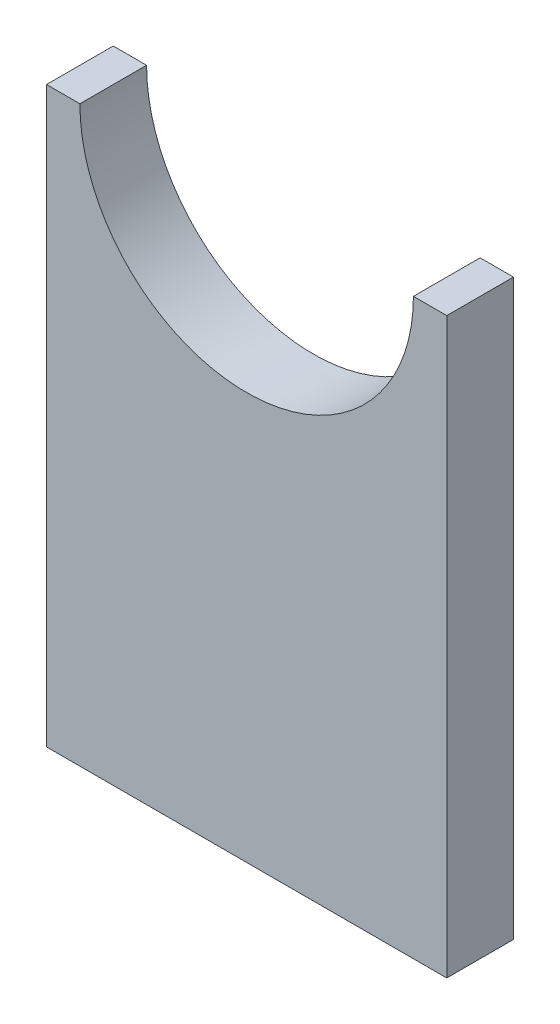
from build123d import *

# Parameters (mm, degrees)
SKETCH2_W           = 30
SKETCH2_H           = 43
BOSS_EXTRUDE2_DEPTH = 5
SKETCH3_R           = 12.5
CUT_EXTRUDE1_DEPTH  = 27.68801229


with BuildPart() as part:
    # Sketch2 → Boss-Extrude2 (new body)
    with BuildSketch(Plane.XY):
        Rectangle(SKETCH2_W, SKETCH2_H)
    extrude(amount=BOSS_EXTRUDE2_DEPTH)

    # Sketch3 → Cut-Extrude1 (cut, through all)
    with BuildSketch(Plane(origin=(0, 0, 0), x_dir=(-1, 0, 0), z_dir=(0, 0, -1))):
        with Locations((0, 21.5)):
            Circle(SKETCH3_R)
    extrude(amount=-CUT_EXTRUDE1_DEPTH, mode=Mode.SUBTRACT)


solid = part.part
